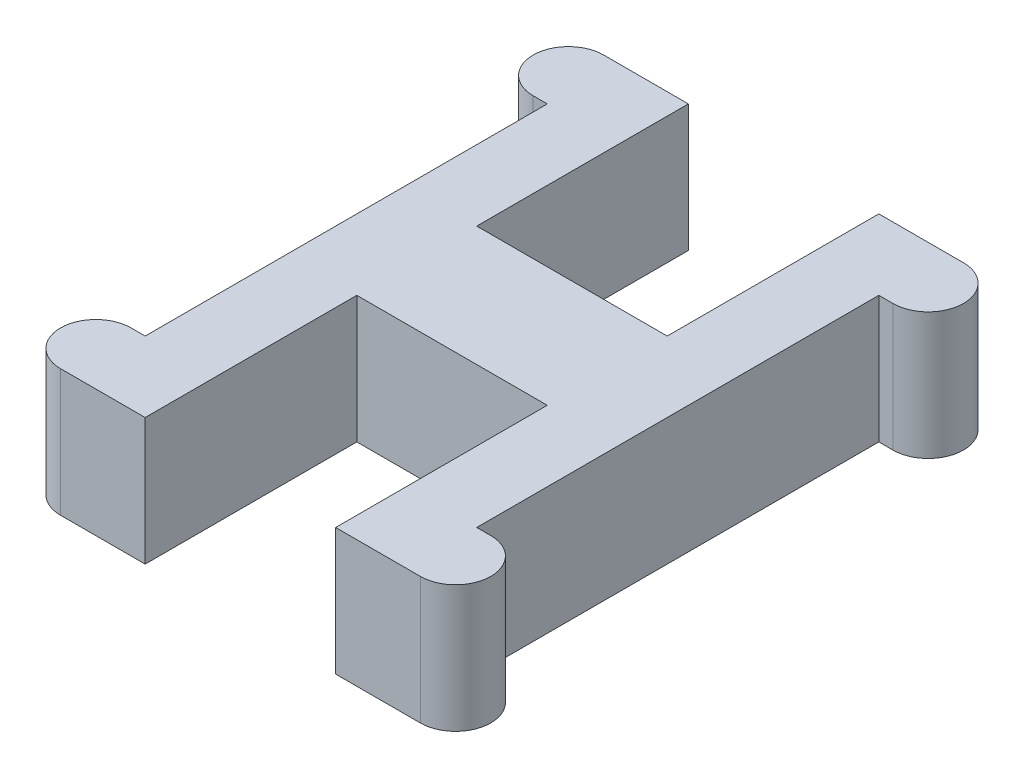
from build123d import *

# Parameters (mm, degrees)
BOSS_EXTRUDE1_DEPTH = 1.8


with BuildPart() as part:
    # Sketch1 → Boss-Extrude1 (new body)
    with BuildSketch(Plane(origin=(0, 0, 0), x_dir=(1, 0, 0), z_dir=(0, 1, 0))):
        with BuildLine():
            Line((-2.35, -2.85), (-2.55, -2.85))
            ThreePointArc((-2.55, -2.85), (-3.05, -3.35), (-2.55, -3.85))
            Line((-2.55, -3.85), (-1.35, -3.85))
            Line((-1.35, -3.85), (-1.35, -0.85))
            Line((-1.35, -0.85), (1.35, -0.85))
            Line((1.35, -0.85), (1.35, -3.85))
            Line((1.35, -3.85), (2.55, -3.85))
            ThreePointArc((2.55, -3.85), (3.05, -3.35), (2.55, -2.85))
            Line((2.55, -2.85), (2.35, -2.85))
            Line((2.35, -2.85), (2.35, 2.85))
            Line((2.35, 2.85), (2.55, 2.85))
            ThreePointArc((2.55, 2.85), (3.05, 3.35), (2.55, 3.85))
            Line((2.55, 3.85), (1.35, 3.85))
            Line((1.35, 3.85), (1.35, 0.85))
            Line((1.35, 0.85), (-1.35, 0.85))
            Line((-1.35, 0.85), (-1.35, 3.85))
            Line((-1.35, 3.85), (-2.55, 3.85))
            ThreePointArc((-2.55, 3.85), (-3.05, 3.35), (-2.55, 2.85))
            Line((-2.55, 2.85), (-2.35, 2.85))
            Line((-2.35, 2.85), (-2.35, -2.85))
        make_face()
    extrude(amount=BOSS_EXTRUDE1_DEPTH)


solid = part.part
